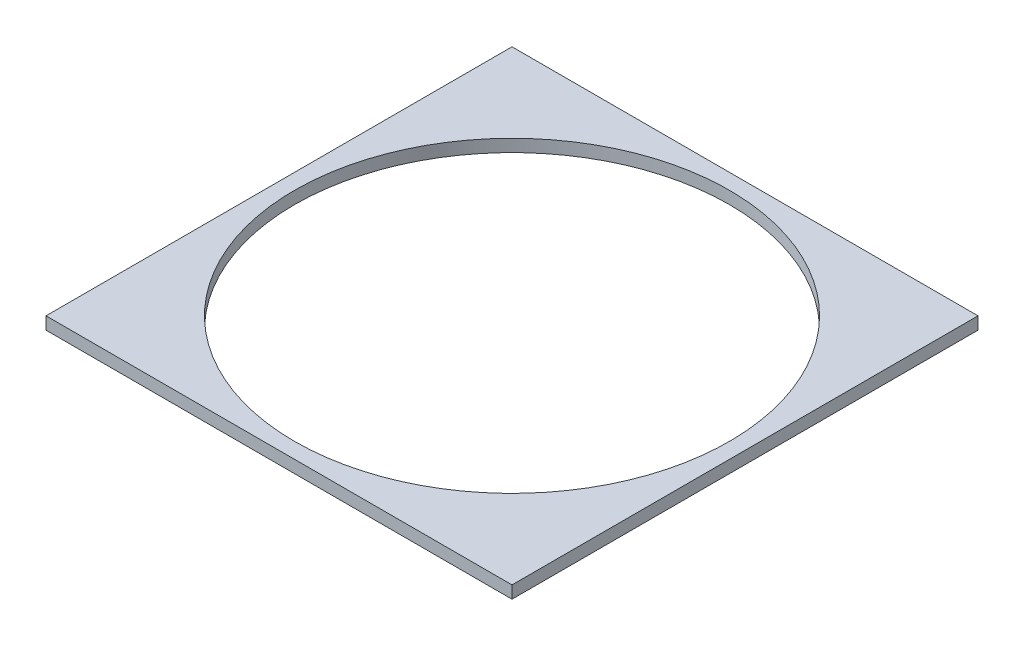
from build123d import *

# Parameters (mm, degrees)
SKETCH1_W           = 300
SKETCH1_H           = 300
BOSS_EXTRUDE1_DEPTH = 8
SKETCH2_R           = 140
CUT_EXTRUDE1_DEPTH  = 10


with BuildPart() as part:
    # Sketch1 → Boss-Extrude1 (new body)
    with BuildSketch(Plane(origin=(0, 0, 0), x_dir=(1, 0, 0), z_dir=(0, 1, 0))):
        Rectangle(SKETCH1_W, SKETCH1_H)
    extrude(amount=BOSS_EXTRUDE1_DEPTH)

    # Sketch2 → Cut-Extrude1 (cut)
    with BuildSketch(Plane(origin=(0, 8, 0), x_dir=(1, 0, 0), z_dir=(0, 1, 0))):
        with Locations(Location((0, 0, 0), (0, 0, 270))):
            Circle(SKETCH2_R)
    extrude(amount=-CUT_EXTRUDE1_DEPTH, mode=Mode.SUBTRACT)


solid = part.part
